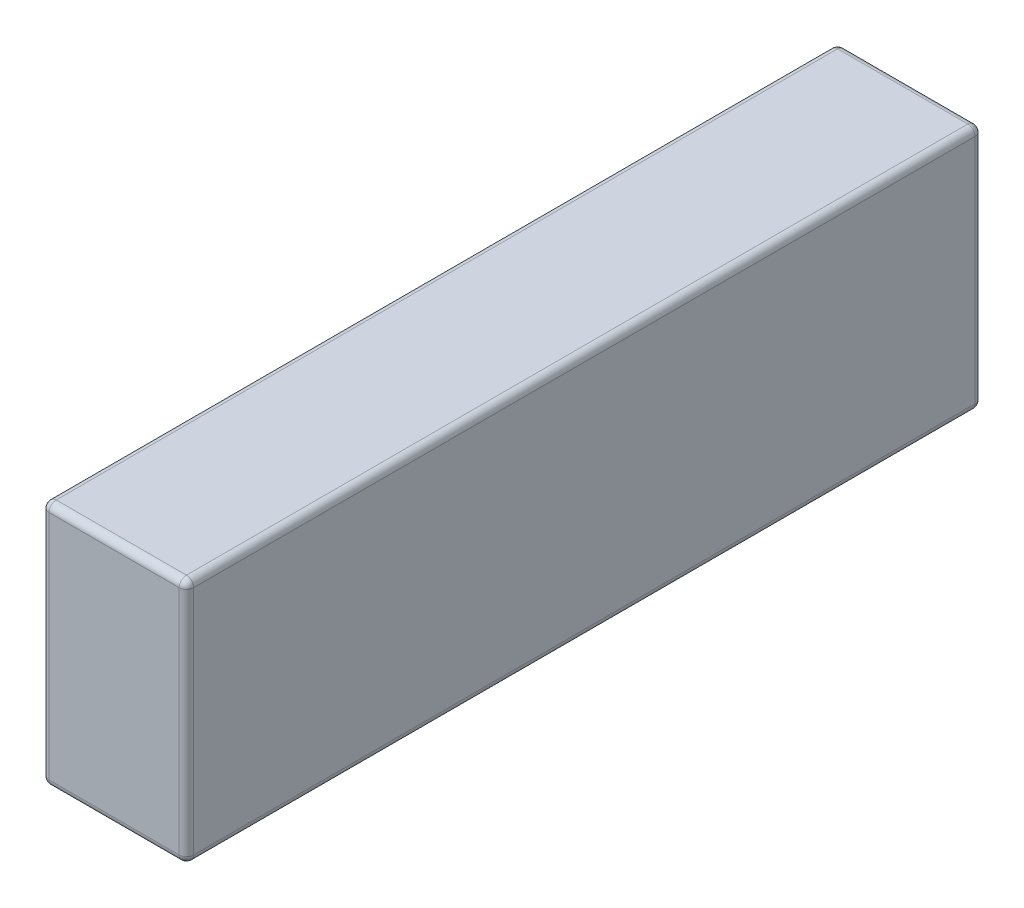
from build123d import *

# Parameters (mm, degrees)
SKETCH1_W           = 20
SKETCH1_H           = 110
BOSS_EXTRUDE1_DEPTH = 34
FILLET1_R           = 1


with BuildPart() as part:
    # Sketch1 → Boss-Extrude1 (new body)
    with BuildSketch(Plane(origin=(0, 0, 0), x_dir=(1, 0, 0), z_dir=(0, 1, 0))):
        with Locations((-5, -4.553571429)):
            Rectangle(SKETCH1_W, SKETCH1_H)
    extrude(amount=BOSS_EXTRUDE1_DEPTH)

    # Fillet1
    fillet1_edges = [part.edges().sort_by_distance(p)[0] for p in [
        (5, 34, 4.553571429),
        (-5, 34, -50.446428571),
        (-15, 34, 4.553571429),
        (-5, 0, -50.446428571),
        (5, 0, 4.553571429),
        (-5, 0, 59.553571429),
        (-15, 0, 4.553571429),
        (-5, 34, 59.553571429),
        (-15, 17, -50.446428571),
        (5, 17, -50.446428571),
        (5, 17, 59.553571429),
        (-15, 17, 59.553571429),
    ]]
    fillet(fillet1_edges, radius=FILLET1_R)


solid = part.part
